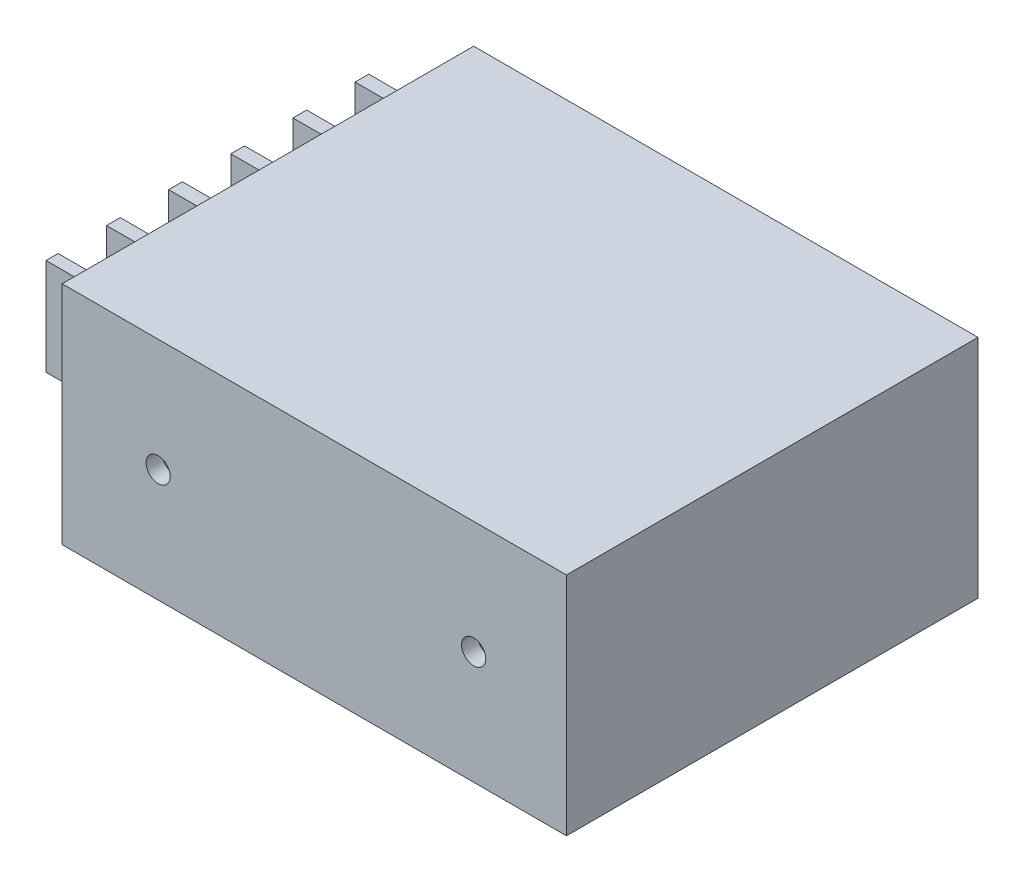
from build123d import *

# Parameters (mm, degrees)
SKETCH_2_W          = 62.5
SKETCH_2_H          = 51
EXTRUDE_1_DEPTH     = 28
SKETCH_3_W          = 40
SKETCH_3_H          = 12
EXTRUDE_2_DEPTH     = 13
SKETCH_4_W          = 6
SKETCH_4_H          = 12
CUT_EXTRUDE_1_DEPTH = 10
SKETCH_5_R          = 1.5
CUT_EXTRUDE_2_DEPTH = 2
SKETCH_6_R          = 1.5
CUT_EXTRUDE_3_DEPTH = 2
SKETCH_7_W          = 5.78199364
SKETCH_7_H          = 8.10559856
SKETCH_7_W_2        = 5.673918992
SKETCH_7_W_3        = 6.075299316
SKETCH_7_W_4        = 6.296826946
SKETCH_7_W_5        = 1.336842802
SKETCH_7_H_2        = 0.41488225
SKETCH_7_W_6        = 6.589057281
CUT_EXTRUDE_4_DEPTH = 0.2
SKETCH_8_R          = 0.1
CUT_EXTRUDE_5_DEPTH = 0.2


with BuildPart() as part:
    # Эскиз2 → Бобышка-Вытянуть1 (new body)
    with BuildSketch(Plane(origin=(0, 0, 0), x_dir=(1, 0, 0), z_dir=(0, 1, 0))):
        Rectangle(SKETCH_2_W, SKETCH_2_H)
    extrude(amount=EXTRUDE_1_DEPTH)

    # Эскиз3 → Бобышка-Вытянуть2 (add)
    with BuildSketch(Plane.ZY.offset(31.25)):
        with Locations((-5.5, 12.5)):
            Rectangle(SKETCH_3_W, SKETCH_3_H)
    extrude(amount=EXTRUDE_2_DEPTH)

    # Эскиз4 → Вырез-Вытянуть1 (cut)
    with BuildSketch(Plane.ZY.offset(44.25)):
        with Locations((-20.8, 12.5)):
            Rectangle(SKETCH_4_W, SKETCH_4_H)
        with Locations((-13.1, 12.5)):
            Rectangle(SKETCH_4_W, SKETCH_4_H)
        with Locations((-5.4, 12.5)):
            Rectangle(SKETCH_4_W, SKETCH_4_H)
        with Locations((2.3, 12.5)):
            Rectangle(SKETCH_4_W, SKETCH_4_H)
        with Locations((10, 12.5)):
            Rectangle(SKETCH_4_W, SKETCH_4_H)
    extrude(amount=-CUT_EXTRUDE_1_DEPTH, mode=Mode.SUBTRACT)

    # Эскиз5 → Вырез-Вытянуть2 (cut)
    with BuildSketch(Plane.XZ):
        with Locations(Location((-22.5, 0, 0), (0, 0, 270))):
            Circle(SKETCH_5_R)
        with Locations(Location((16.6, 0, 0), (0, 0, 270))):
            Circle(SKETCH_5_R)
    extrude(amount=-CUT_EXTRUDE_2_DEPTH, mode=Mode.SUBTRACT)

    # Эскиз6 → Вырез-Вытянуть3 (cut)
    with BuildSketch(Plane.XY.offset(25.5)):
        with Locations((-19.35, 14)):
            Circle(SKETCH_6_R)
        with Locations((19.75, 14)):
            Circle(SKETCH_6_R)
    extrude(amount=-CUT_EXTRUDE_3_DEPTH, mode=Mode.SUBTRACT)

    # Эскиз7 → Вырез-Вытянуть4 (cut)
    # profile 1 of 5: a face of its own
    with BuildSketch(Plane.ZY.offset(31.25)):
        with Locations((-20.885425623, 22.997214402)):
            Rectangle(SKETCH_7_W, SKETCH_7_H)
        Polygon((-21.978599363, 21.538206661), (-21.978599363, 25.13385282), (-21.471521059, 25.13385282), (-21.471521059, 21.95308891), (-19.765894035, 21.95308891), (-19.765894035, 21.538206661), align=None, mode=Mode.SUBTRACT)
    # profile 2 of 5: a face of its own
    with BuildSketch(Plane.ZY.offset(31.25)):
        with Locations((-13.104051005, 22.997214402)):
            Rectangle(SKETCH_7_W_2, SKETCH_7_H)
        Polygon((-15.063895212, 21.538206661), (-15.063895212, 25.13385282), (-14.52800564, 25.13385282), (-12.805091856, 22.450803553), (-12.805091856, 25.13385282), (-12.298013551, 25.13385282), (-12.298013551, 21.538206661), (-12.833903123, 21.538206661), (-14.556816907, 24.221255928), (-14.556816907, 21.538206661), align=None, mode=Mode.SUBTRACT)
    # profile 3 of 5: a face of its own
    with BuildSketch(Plane.ZY.offset(31.25)):
        with Locations((-5.446210168, 22.997214402)):
            Rectangle(SKETCH_7_W_3, SKETCH_7_H)
        with BuildLine():
            Line((-5.659897566, 22.967245519), (-5.659897566, 23.382127768))
            Line((-5.659897566, 23.382127768), (-4.18476068, 23.382127768))
            Line((-4.18476068, 23.382127768), (-4.18476068, 22.0517675))
            add(Edge.make_bspline(
                [(-4.18476068, 22.0517675), (-4.242962303, 22.007439509), (-4.35751032, 21.920196522), (-4.537155527, 21.806419301), (-4.719747223, 21.709922694), (-4.904780787, 21.630258233), (-5.092892204, 21.568773161), (-5.283269339, 21.524763593), (-5.476119509, 21.496888425), (-5.605783778, 21.493703303), (-5.670701791, 21.492108633)],
                knots=[0, 0, 0, 0, 1.08433114, 2.134098231, 3.14842993, 4.143565882, 5.117308249, 6.078377492, 7.037916032, 8, 8, 8, 8], degree=3))
            add(Edge.make_bspline(
                [(-5.670701791, 21.492108633), (-5.7141834, 21.492776114), (-5.800561126, 21.494102087), (-5.928447738, 21.505445854), (-6.053348194, 21.522301078), (-6.175025587, 21.547085775), (-6.293909485, 21.578639415), (-6.409770903, 21.617634069), (-6.522658406, 21.663137861), (-6.631942729, 21.715305944), (-6.735981259, 21.775077196), (-6.834487723, 21.840611664), (-6.926219433, 21.912896614), (-7.011317583, 21.991340794), (-7.089474481, 22.076410898), (-7.161848123, 22.166976275), (-7.226497209, 22.26469649), (-7.284849299, 22.367774056), (-7.336374402, 22.475428954), (-7.381362856, 22.586742481), (-7.418550073, 22.701447598), (-7.449564709, 22.819036861), (-7.474229212, 22.939465951), (-7.491456602, 23.063112304), (-7.501597481, 23.189881352), (-7.503073428, 23.275507905), (-7.503818673, 23.31874298)],
                knots=[0, 0, 0, 0, 1.072770755, 2.131096365, 3.165876834, 4.181397123, 5.193125461, 6.199217581, 7.195986042, 8.195005739, 9.184865672, 10.154356418, 11.112044544, 12.063776475, 13.007136321, 13.960176652, 14.921449994, 15.895149614, 16.88092309, 17.86448639, 18.855604391, 19.854360534, 20.864074582, 21.88711945, 22.933151623, 24, 24, 24, 24], degree=3))
            add(Edge.make_bspline(
                [(-7.503818673, 23.31874298), (-7.503071379, 23.361737955), (-7.501587281, 23.447124319), (-7.491359779, 23.574362779), (-7.474069267, 23.699373423), (-7.450199023, 23.822227741), (-7.42007483, 23.942819164), (-7.382546633, 24.061171038), (-7.337647317, 24.177174944), (-7.286795828, 24.290585738), (-7.230159685, 24.399780724), (-7.16511853, 24.501270207), (-7.096736009, 24.597425508), (-7.01937037, 24.684066396), (-6.938406144, 24.765666277), (-6.84988181, 24.838291785), (-6.756028672, 24.904129119), (-6.656440815, 24.962470674), (-6.551704051, 25.013385726), (-6.443068221, 25.058226901), (-6.330286769, 25.095436718), (-6.214006123, 25.126829943), (-6.09358196, 25.150155602), (-5.969324679, 25.167702176), (-5.841093881, 25.177724259), (-5.754271112, 25.179202494), (-5.710317283, 25.179950847)],
                knots=[0, 0, 0, 0, 1.059979929, 2.105079288, 3.144800512, 4.169876923, 5.189194625, 6.207600986, 7.228841866, 8.254191695, 9.270945245, 10.257936415, 11.22408152, 12.176290364, 13.118065146, 14.055588944, 14.994904974, 15.942096138, 16.897776019, 17.864011786, 18.837383209, 19.823806203, 20.831455606, 21.859450402, 22.916351634, 24, 24, 24, 24], degree=3))
            add(Edge.make_bspline(
                [(-5.710317283, 25.179950847), (-5.646865743, 25.178424318), (-5.522889801, 25.175441681), (-5.341380913, 25.15224425), (-5.169716641, 25.112550212), (-5.033674129, 25.06694602), (-4.93149534, 25.022504087), (-4.859269839, 24.986586046), (-4.791379237, 24.947364041), (-4.727042057, 24.906112669), (-4.667694932, 24.860125011), (-4.612558039, 24.8115635), (-4.561486282, 24.759845892), (-4.498609452, 24.686034929), (-4.426681045, 24.583504205), (-4.354510197, 24.444273409), (-4.291297367, 24.289068771), (-4.260011068, 24.177922642), (-4.243823778, 24.120416492)],
                knots=[0, 0, 0, 0, 1.539867261, 3.008697525, 4.432261777, 5.810773619, 6.484177873, 7.135742803, 7.767512201, 8.386601754, 8.989234153, 9.587908519, 10.168964172, 10.7517707, 11.940093668, 13.199243526, 14.550910222, 16, 16, 16, 16], degree=3))
            Line((-4.243823778, 24.120416492), (-4.707685181, 24.00373086))
            add(Edge.make_bspline(
                [(-4.707685181, 24.00373086), (-4.721073387, 24.046402442), (-4.746714784, 24.128128032), (-4.791879281, 24.242351787), (-4.844492117, 24.340983083), (-4.900748202, 24.42780068), (-4.967768762, 24.502484616), (-5.04558227, 24.568659762), (-5.136518657, 24.62613069), (-5.238575454, 24.675337114), (-5.349529117, 24.715518324), (-5.467620817, 24.7441522), (-5.591648189, 24.761960167), (-5.676402731, 24.764017872), (-5.719680945, 24.765068598)],
                knots=[0, 0, 0, 0, 1.164883671, 2.23101188, 3.193404931, 4.072828119, 4.918883984, 5.797350418, 6.725503451, 7.712871826, 8.743577122, 9.793233972, 10.87315899, 12, 12, 12, 12], degree=3))
            add(Edge.make_bspline(
                [(-5.719680945, 24.765068598), (-5.770873228, 24.763778124), (-5.869987767, 24.761279609), (-6.013618655, 24.743368551), (-6.146534446, 24.71281366), (-6.268289641, 24.669275517), (-6.37837288, 24.615757956), (-6.478359202, 24.555241433), (-6.566553587, 24.485960685), (-6.643291269, 24.408799416), (-6.710027374, 24.326255566), (-6.769537751, 24.240215739), (-6.821289749, 24.149985767), (-6.848931335, 24.086600055), (-6.862767975, 24.054870859)],
                knots=[0, 0, 0, 0, 1.282088634, 2.482280855, 3.618640035, 4.691464057, 5.71354971, 6.679981643, 7.61357903, 8.515091979, 9.399860987, 10.268958177, 11.133486685, 12, 12, 12, 12], degree=3))
            add(Edge.make_bspline(
                [(-6.862767975, 24.054870859), (-6.883430077, 23.99906483), (-6.925019296, 23.886737), (-6.965647862, 23.709705064), (-6.991874148, 23.526015053), (-6.995102026, 23.400948882), (-6.996740368, 23.337470304)],
                knots=[0, 0, 0, 0, 0.971932623, 1.956331326, 2.96271565, 4, 4, 4, 4], degree=3))
            add(Edge.make_bspline(
                [(-6.996740368, 23.337470304), (-6.996492081, 23.298556312), (-6.99600568, 23.222322555), (-6.987287728, 23.110389894), (-6.975888726, 23.003014279), (-6.957388751, 22.900722277), (-6.935393972, 22.803209014), (-6.90811271, 22.710421156), (-6.874765461, 22.622821832), (-6.837518634, 22.539553231), (-6.794901855, 22.461514832), (-6.747443445, 22.388789744), (-6.695319551, 22.321416758), (-6.638707919, 22.259321555), (-6.578448327, 22.201256794), (-6.512653559, 22.149438281), (-6.442063477, 22.103113409), (-6.343028456, 22.04794612), (-6.212447725, 21.992254151), (-6.05058386, 21.942565796), (-5.883295566, 21.913054616), (-5.770214531, 21.90902343), (-5.71319841, 21.906990882)],
                knots=[0, 0, 0, 0, 1.070760406, 2.097653971, 3.088708526, 4.041547766, 4.95691435, 5.839291284, 6.700934147, 7.534993757, 8.348268852, 9.145600082, 9.922850605, 10.690119832, 11.456705726, 12.223547942, 12.991528328, 13.778467112, 15.341275849, 16.888285822, 18.431055468, 20, 20, 20, 20], degree=3))
            add(Edge.make_bspline(
                [(-5.71319841, 21.906990882), (-5.663182815, 21.908636915), (-5.563382146, 21.911921393), (-5.414799744, 21.934713134), (-5.26855323, 21.973414288), (-5.127155939, 22.025665166), (-4.994888026, 22.085514198), (-4.877808255, 22.149642358), (-4.776140271, 22.213631755), (-4.71895216, 22.262629138), (-4.691838984, 22.285859047)],
                knots=[0, 0, 0, 0, 1.08078364, 2.156585965, 3.240205791, 4.344938036, 5.41078367, 6.374425311, 7.229306744, 8, 8, 8, 8], degree=3))
            Line((-4.691838984, 22.285859047), (-4.691838984, 22.967245519))
            Line((-4.691838984, 22.967245519), (-5.659897566, 22.967245519))
        make_face(mode=Mode.SUBTRACT)
    # profile 4 of 5: a face of its own
    with BuildSketch(Plane.ZY.offset(31.25)):
        with Locations((1.931094958, 22.997214402)):
            Rectangle(SKETCH_7_W_4, SKETCH_7_H)
        with Locations((-0.289477341, 22.805902422)):
            Rectangle(SKETCH_7_W_5, SKETCH_7_H_2, mode=Mode.SUBTRACT)
        with BuildLine():
            Line((1.970766578, 21.538206661), (0.520839552, 25.13385282))
            Line((0.520839552, 25.13385282), (1.070414475, 25.13385282))
            Line((1.070414475, 25.13385282), (2.048557, 22.55668496))
            add(Edge.make_bspline(
                [(2.048557, 22.55668496), (2.06769828, 22.505849218), (2.10514257, 22.406404022), (2.157358664, 22.25883417), (2.204036707, 22.116126601), (2.232178309, 22.022054413), (2.245914181, 21.976137924)],
                knots=[0, 0, 0, 0, 1.062747156, 2.078952616, 3.062339733, 4, 4, 4, 4], degree=3))
            add(Edge.make_bspline(
                [(2.245914181, 21.976137924), (2.27515583, 22.073235246), (2.334058381, 22.268822029), (2.405257545, 22.460276407), (2.441110517, 22.55668496)],
                knots=[0, 0, 0, 0, 0.992882236, 2, 2, 2, 2], degree=3))
            Line((2.441110517, 22.55668496), (3.421413887, 25.13385282))
            Line((3.421413887, 25.13385282), (3.970988811, 25.13385282))
            Line((3.970988811, 25.13385282), (2.520341502, 21.538206661))
            Line((2.520341502, 21.538206661), (1.970766578, 21.538206661))
        make_face(mode=Mode.SUBTRACT)
    # profile 5 of 5: a face of its own
    with BuildSketch(Plane.ZY.offset(31.25)):
        with Locations((9.931962025, 22.997214402)):
            Rectangle(SKETCH_7_W_6, SKETCH_7_H)
        Polygon((7.892922572, 22.137481021), (7.892922572, 23.105539602), (6.92486399, 23.105539602), (6.92486399, 23.520421851), (7.892922572, 23.520421851), (7.892922572, 24.488480432), (8.307804821, 24.488480432), (8.307804821, 23.520421851), (9.275863402, 23.520421851), (9.275863402, 23.105539602), (8.307804821, 23.105539602), (8.307804821, 22.137481021), align=None, mode=Mode.SUBTRACT)
        with BuildLine():
            Line((10.959881976, 21.538206661), (9.509954949, 25.13385282))
            Line((9.509954949, 25.13385282), (10.059529873, 25.13385282))
            Line((10.059529873, 25.13385282), (11.037672397, 22.55668496))
            add(Edge.make_bspline(
                [(11.037672397, 22.55668496), (11.056813677, 22.505849218), (11.094257968, 22.406404022), (11.146474061, 22.25883417), (11.193152105, 22.116126601), (11.221293706, 22.022054413), (11.235029578, 21.976137924)],
                knots=[0, 0, 0, 0, 1.062747156, 2.078952616, 3.062339733, 4, 4, 4, 4], degree=3))
            add(Edge.make_bspline(
                [(11.235029578, 21.976137924), (11.264271227, 22.073235246), (11.323173778, 22.268822029), (11.394372942, 22.460276407), (11.430225914, 22.55668496)],
                knots=[0, 0, 0, 0, 0.992882236, 2, 2, 2, 2], degree=3))
            Line((11.430225914, 22.55668496), (12.410529284, 25.13385282))
            Line((12.410529284, 25.13385282), (12.960104208, 25.13385282))
            Line((12.960104208, 25.13385282), (11.509456899, 21.538206661))
            Line((11.509456899, 21.538206661), (10.959881976, 21.538206661))
        make_face(mode=Mode.SUBTRACT)
    extrude(amount=-CUT_EXTRUDE_4_DEPTH, mode=Mode.SUBTRACT)

    # Эскиз8 → Вырез-Вытянуть5 (cut)
    with BuildSketch(Plane.ZY.offset(34.25)):
        with Locations((-20.912444285, 12.513973597)):
            Circle(SKETCH_8_R)
        with Locations((-13.347218962, 12.513973597)):
            Circle(SKETCH_8_R)
        with Locations((-5.241620402, 12.513973597)):
            Circle(SKETCH_8_R)
        with Locations((2.053418302, 12.513973597)):
            Circle(SKETCH_8_R)
        with Locations((10.050942214, 12.513973597)):
            Circle(SKETCH_8_R)
    extrude(amount=-CUT_EXTRUDE_5_DEPTH, mode=Mode.SUBTRACT)


solid = part.part
